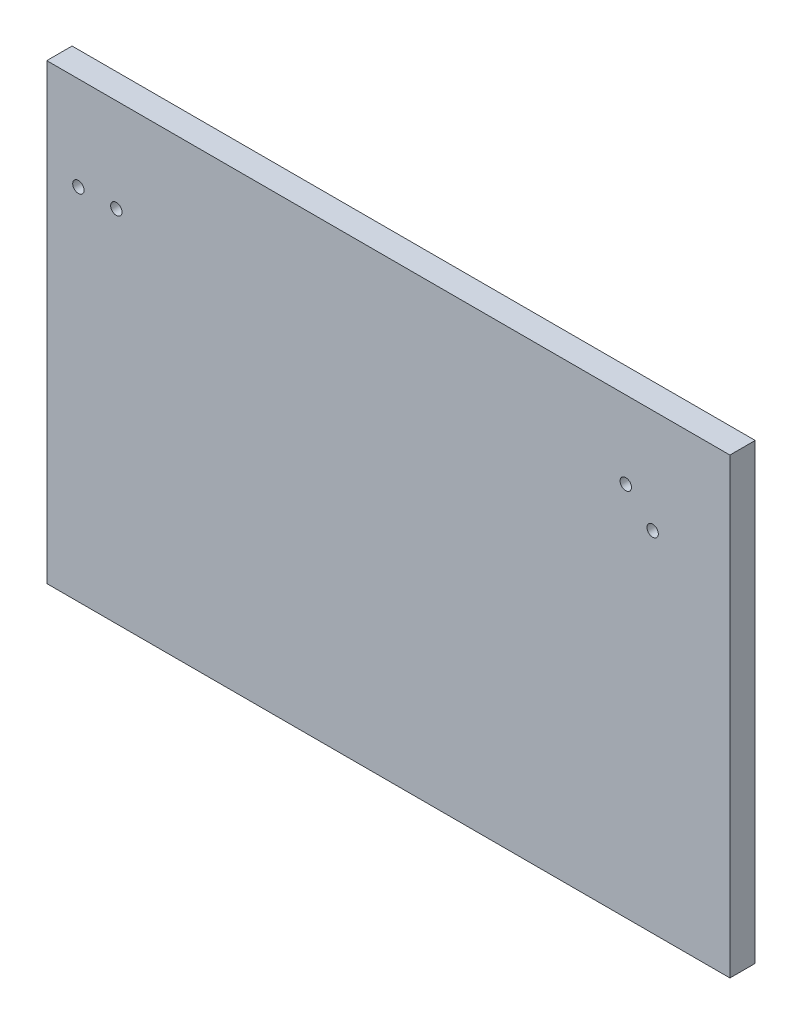
from build123d import *

# Parameters (mm, degrees)
SCHIZZO1_W                   = 270
SCHIZZO1_H                   = 179
ESTRUSIONE_ESTRUSIONE1_DEPTH = 10
SCHIZZO2_R                   = 2.25
TAGLIO_ESTRUSIONE1_DEPTH     = 10


with BuildPart() as part:
    # Schizzo1 → Estrusione-Estrusione1 (new body)
    with BuildSketch(Plane.XY):
        with Locations((-135, 89.5)):
            Rectangle(SCHIZZO1_W, SCHIZZO1_H)
    extrude(amount=ESTRUSIONE_ESTRUSIONE1_DEPTH)

    # Schizzo2 → Taglio-Estrusione1 (cut)
    with BuildSketch(Plane(origin=(0, 0, 0), x_dir=(-1, 0, 0), z_dir=(0, 0, -1))):
        with Locations((41.161165235, 148.445436483)):
            Circle(SCHIZZO2_R)
        with Locations((30.554563517, 137.838834765)):
            Circle(SCHIZZO2_R)
        with Locations((242.5, 142)):
            Circle(SCHIZZO2_R)
        with Locations((257.5, 142)):
            Circle(SCHIZZO2_R)
    extrude(amount=-TAGLIO_ESTRUSIONE1_DEPTH, mode=Mode.SUBTRACT)


solid = part.part
